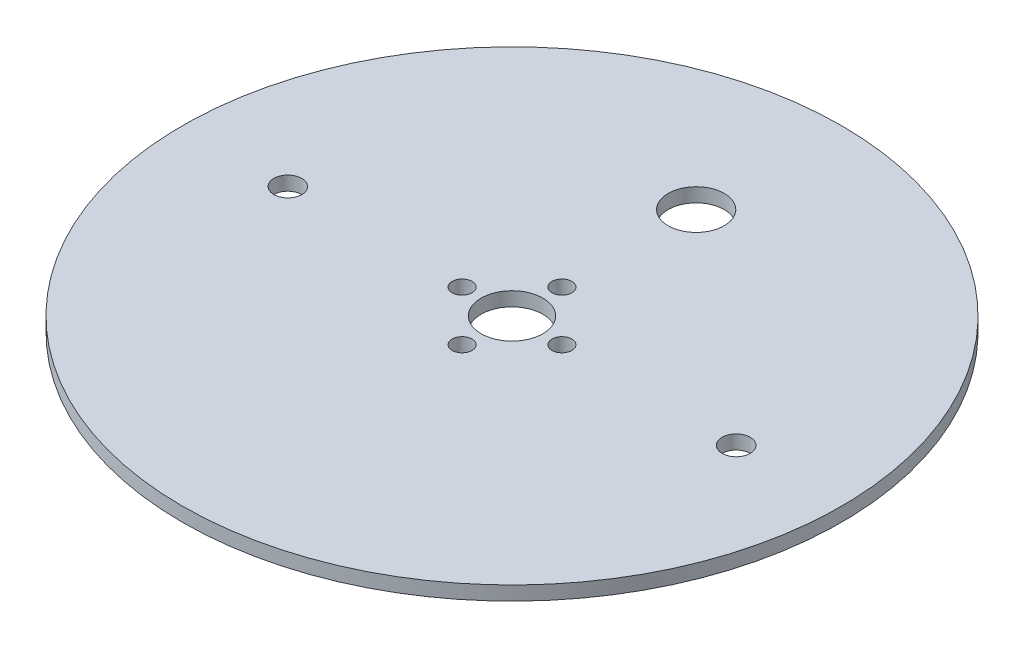
from build123d import *

# Parameters (mm, degrees)
SKETCH1_R           = 74.676
BOSS_EXTRUDE1_DEPTH = 3.175
SKETCH2_R           = 7
CUT_EXTRUDE1_DEPTH  = 106.655527906
SKETCH3_R           = 2.25
CUT_EXTRUDE2_DEPTH  = 106.655527906
SKETCH4_R           = 3.175
CUT_EXTRUDE3_DEPTH  = 106.655527906
CUT_EXTRUDE5_REACH  = 107.656
SKETCH6_R           = 6.35


with BuildPart() as part:
    # Sketch1 → Boss-Extrude1 (new body)
    with BuildSketch(Plane(origin=(0, 0, 0), x_dir=(1, 0, 0), z_dir=(0, 1, 0))):
        with Locations(Location((0, 0, 0), (0, 0, 270))):
            Circle(SKETCH1_R)
    extrude(amount=BOSS_EXTRUDE1_DEPTH)

    # Sketch2 → Cut-Extrude1 (cut, through all)
    with BuildSketch(Plane(origin=(0, 3.175, 0), x_dir=(1, 0, 0), z_dir=(0, 1, 0))):
        with Locations(Location((0, 0, 0), (0, 0, 270))):
            Circle(SKETCH2_R)
    extrude(amount=-CUT_EXTRUDE1_DEPTH, mode=Mode.SUBTRACT)

    # Sketch3 → Cut-Extrude2 (cut, through all)
    with BuildSketch(Plane(origin=(0, 3.175, 0), x_dir=(1, 0, 0), z_dir=(0, 1, 0))):
        with Locations(Location((11.314, 0, 0), (0, 0, 270))):
            Circle(SKETCH3_R)
        with Locations(Location((0, -11.314, 0), (0, 0, 270))):
            Circle(SKETCH3_R)
        with Locations(Location((-11.314, 0, 0), (0, 0, 270))):
            Circle(SKETCH3_R)
        with Locations(Location((0, 11.314, 0), (0, 0, 270))):
            Circle(SKETCH3_R)
    extrude(amount=-CUT_EXTRUDE2_DEPTH, mode=Mode.SUBTRACT)

    # Sketch4 → Cut-Extrude3 (cut, through all)
    with BuildSketch(Plane(origin=(0, 3.175, 0), x_dir=(1, 0, 0), z_dir=(0, 1, 0))):
        with Locations(Location((50.8, 0, 0), (0, 0, 270))):
            Circle(SKETCH4_R)
        with Locations(Location((-50.8, 0, 0), (0, 0, 270))):
            Circle(SKETCH4_R)
    extrude(amount=-CUT_EXTRUDE3_DEPTH, mode=Mode.SUBTRACT)

    # Sketch6 → Cut-Extrude5 (cut, up to next)
    with BuildSketch(Plane(origin=(0, 3.175, 0), x_dir=(1, 0, 0), z_dir=(0, 1, 0)), mode=Mode.PRIVATE) as cut_extrude5_sk1:
        with Locations(Location((0, 41.73382544, 0), (0, 0, 270))):
            Circle(SKETCH6_R)
    cut_extrude5_tool1 = extrude(cut_extrude5_sk1.sketch, amount=-CUT_EXTRUDE5_REACH, mode=Mode.PRIVATE) & part.part
    add(cut_extrude5_tool1.solids().sort_by_distance((0, 3.175, -41.733825))[0], mode=Mode.SUBTRACT)


solid = part.part
